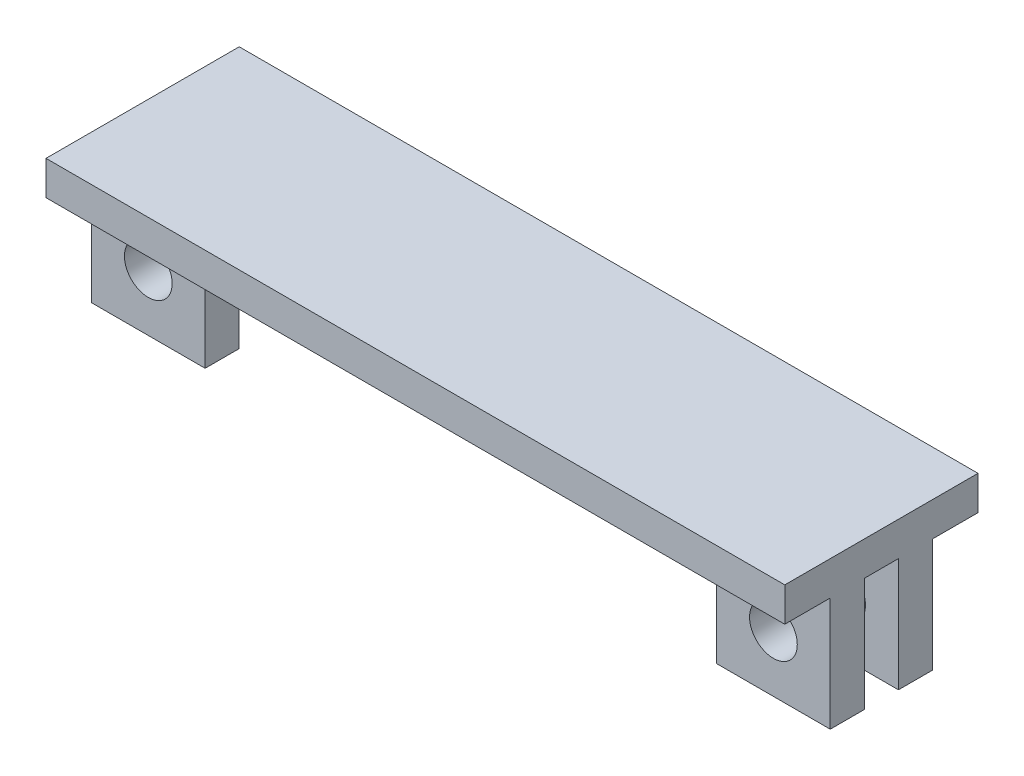
from build123d import *

# Parameters (mm, degrees)
SKETCH_3_W          = 10
SKETCH_3_H          = 3
EXTRUDE_1_DEPTH     = 10
EXTRUDE_1_2_DEPTH   = 10
EXTRUDE_1_3_DEPTH   = 10
EXTRUDE_1_4_DEPTH   = 10
SKETCH_4_W          = 65
SKETCH_4_H          = 9
EXTRUDE_2_DEPTH     = 3
SKETCH_5_R          = 2.1
CUT_EXTRUDE_1_DEPTH = 17
SKETCH_7_W          = 65
SKETCH_7_H          = 3
EXTRUDE_3_DEPTH     = 4
SKETCH_8_W          = 65
SKETCH_8_H          = 3
EXTRUDE_4_DEPTH     = 4


with BuildPart() as part:
    # Эскиз3 → Бобышка-Вытянуть1 (new body)
    with BuildSketch(Plane(origin=(0, 0, 0), x_dir=(1, 0, 0), z_dir=(0, 1, 0))):
        Rectangle(SKETCH_3_W, SKETCH_3_H)
    extrude(amount=EXTRUDE_1_DEPTH)



with BuildPart() as body_2:
    # Эскиз3 → Extrude 1 2 (new body)
    with BuildSketch(Plane(origin=(0, 0, 0), x_dir=(1, 0, 0), z_dir=(0, 1, 0))):
        with Locations((55, 0)):
            Rectangle(SKETCH_3_W, SKETCH_3_H)
    extrude(amount=EXTRUDE_1_2_DEPTH)


with BuildPart() as body_3:
    # Эскиз3 → Extrude 1 3 (new body)
    with BuildSketch(Plane(origin=(0, 0, 0), x_dir=(1, 0, 0), z_dir=(0, 1, 0))):
        with Locations((0, 6)):
            Rectangle(SKETCH_3_W, SKETCH_3_H)
    extrude(amount=EXTRUDE_1_3_DEPTH)


with BuildPart() as body_4:
    # Эскиз3 → Extrude 1 4 (new body)
    with BuildSketch(Plane(origin=(0, 0, 0), x_dir=(1, 0, 0), z_dir=(0, 1, 0))):
        with Locations((55, 6)):
            Rectangle(SKETCH_3_W, SKETCH_3_H)
    extrude(amount=EXTRUDE_1_4_DEPTH)


with BuildPart() as part_1:
    add(part.part)

    add(body_2.part)  # Бобышка-Вытянуть2 merges body 2

    add(body_3.part)  # Бобышка-Вытянуть2 merges body 3

    add(body_4.part)  # Бобышка-Вытянуть2 merges body 4
    # Эскиз4 → Бобышка-Вытянуть2 (add)
    with BuildSketch(Plane(origin=(0, 10, 0), x_dir=(1, 0, 0), z_dir=(0, 1, 0))):
        with Locations((27.5, 3)):
            Rectangle(SKETCH_4_W, SKETCH_4_H)
    extrude(amount=EXTRUDE_2_DEPTH)

    # Эскиз5 → Вырез-Вытянуть1 (cut)
    with BuildSketch(Plane.XY.offset(1.5)):
        with Locations((0, 5)):
            Circle(SKETCH_5_R)
        with Locations((55, 5)):
            Circle(SKETCH_5_R)
    extrude(amount=-CUT_EXTRUDE_1_DEPTH, mode=Mode.SUBTRACT)

    # Эскиз7 → Бобышка-Вытянуть3 (add)
    with BuildSketch(Plane(origin=(0, 0, -7.5), x_dir=(-1, 0, 0), z_dir=(0, 0, -1))):
        with Locations((-27.5, 11.5)):
            Rectangle(SKETCH_7_W, SKETCH_7_H)
    extrude(amount=EXTRUDE_3_DEPTH)

    # Эскиз8 → Бобышка-Вытянуть4 (add)
    with BuildSketch(Plane.XY.offset(1.5)):
        with Locations((27.5, 11.5)):
            Rectangle(SKETCH_8_W, SKETCH_8_H)
    extrude(amount=EXTRUDE_4_DEPTH)


solid = part_1.part
